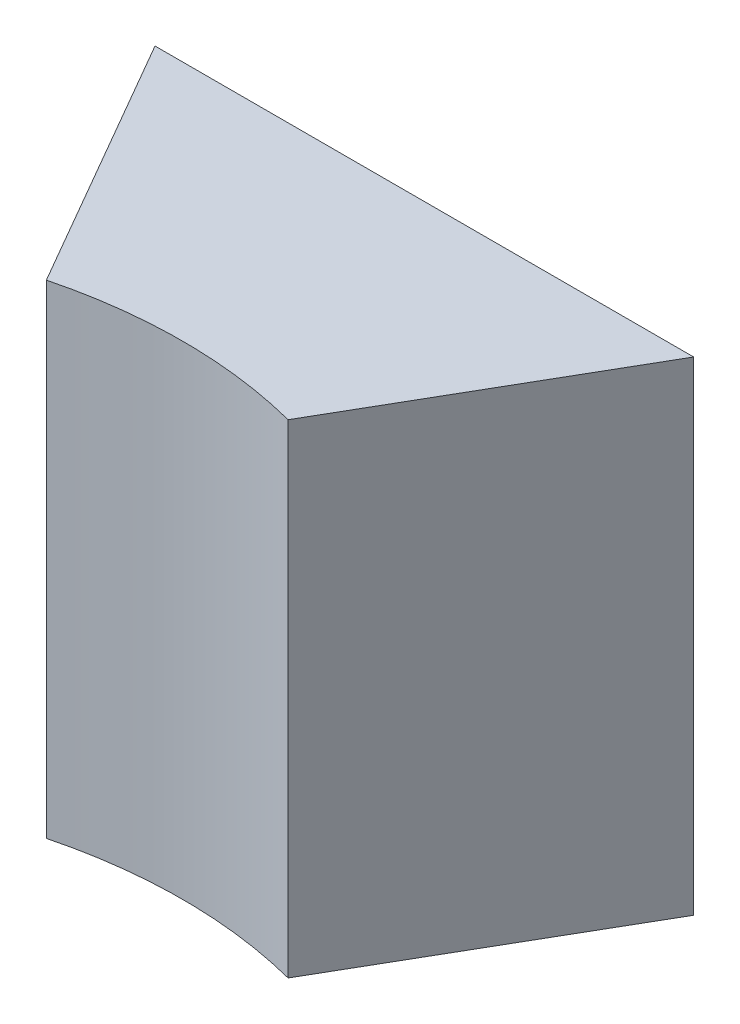
from build123d import *

# Parameters (mm, degrees)
Y_KSEKLIK_EKSTR_ZYON1_DEPTH = 100


with BuildPart() as part:
    # Çizim1 → Yükseklik-Ekstrüzyon1 (new body)
    with BuildSketch(Plane(origin=(0, 0, 0), x_dir=(1, 0, 0), z_dir=(0, 1, 0))):
        with BuildLine():
            Line((55.700840941, 150), (25, 96.824583655))
            ThreePointArc((25, 96.824583655), (0, 100), (-25, 96.824583655))
            Line((-25, 96.824583655), (-55.700840941, 150))
            Line((-55.700840941, 150), (55.700840941, 150))
        make_face()
    extrude(amount=Y_KSEKLIK_EKSTR_ZYON1_DEPTH)


solid = part.part
